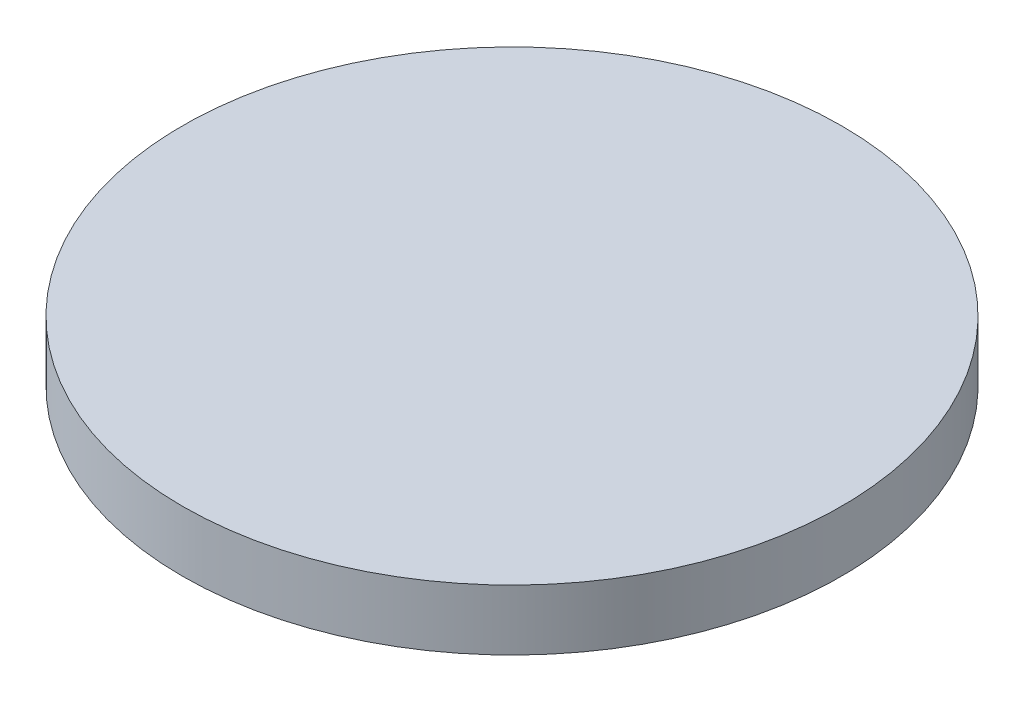
from build123d import *

# Parameters (mm, degrees)
SKETCH2_R           = 10.6045
BOSS_EXTRUDE1_DEPTH = 1.95


with BuildPart() as part:
    # Sketch2 → Boss-Extrude1 (new body)
    with BuildSketch(Plane(origin=(0, 0, 0), x_dir=(1, 0, 0), z_dir=(0, 1, 0))):
        with Locations(Location((0, 0, 0), (0, 0, 270))):
            Circle(SKETCH2_R)
    extrude(amount=BOSS_EXTRUDE1_DEPTH)


solid = part.part
